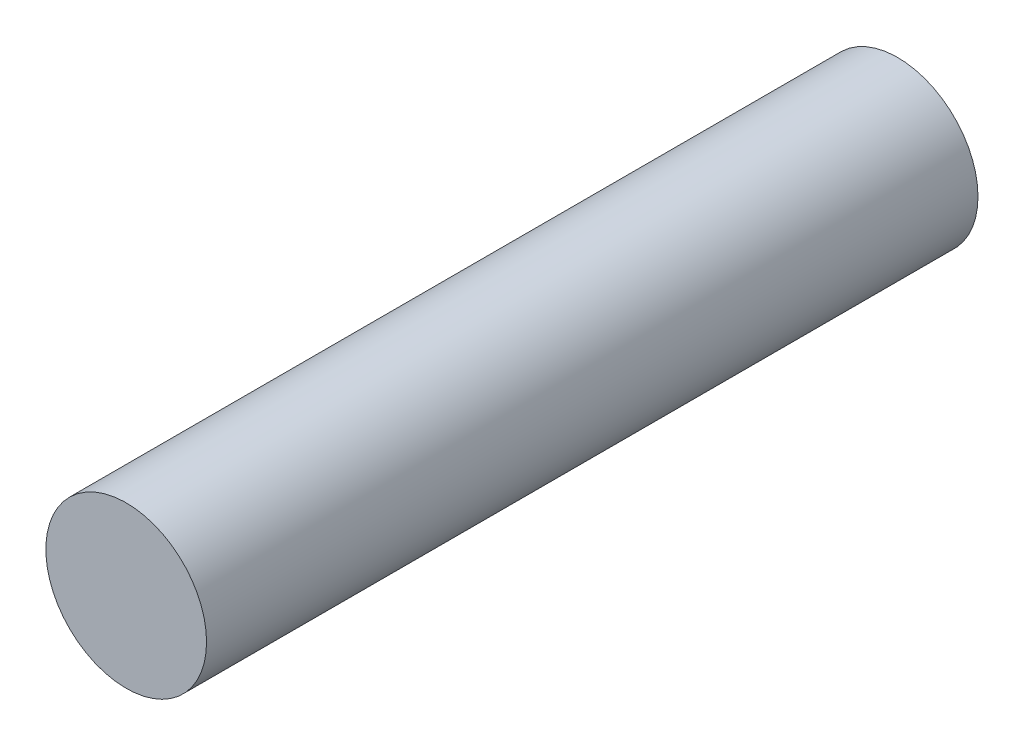
from build123d import *

# Parameters (mm, degrees)
SKETCH_1_R      = 5
EXTRUDE_1_DEPTH = 48


with BuildPart() as part:
    # 草图1 → 凸台-拉伸1 (new body)
    with BuildSketch(Plane.XY):
        Circle(SKETCH_1_R)
    extrude(amount=EXTRUDE_1_DEPTH)


solid = part.part
